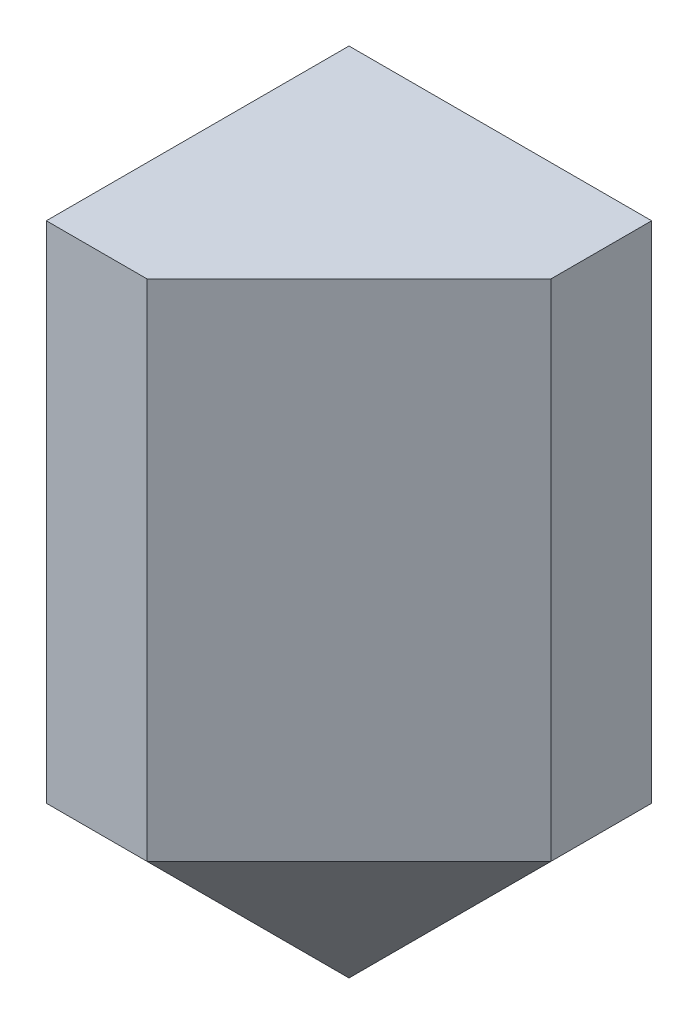
from build123d import *

# Parameters (mm, degrees)
SCHIZZO1_W                   = 30
SCHIZZO1_H                   = 40
ESTRUSIONE_ESTRUSIONE1_DEPTH = 30
SMUSSO1_SIZE                 = 20
ESTRUSIONE_ESTRUSIONE2_DEPTH = 30
FORO_PER_VITE_M5_1_D         = 5.5
FORO_PER_VITE_M5_1_DEPTH     = 13
FORO_PER_VITE_M5_1_TIP       = 1.652366702
FORO_PER_VITE_M5_2_D         = 5.5
FORO_PER_VITE_M5_2_DEPTH     = 13
FORO_PER_VITE_M5_2_TIP       = 1.652366702
SCHIZZO6_R                   = 7.5
TAGLIO_ESTRUSIONE1_DEPTH     = 3
FORO_PER_VITE_M4_1_D         = 4.5
FORO_PER_VITE_M4_1_DEPTH     = 10
FORO_PER_VITE_M4_1_TIP       = 1.351936393


with BuildPart() as part:
    # Schizzo1 → Estrusione-Estrusione1 (new body)
    with BuildSketch(Plane.XY):
        with Locations((15, 20)):
            Rectangle(SCHIZZO1_W, SCHIZZO1_H)
    extrude(amount=ESTRUSIONE_ESTRUSIONE1_DEPTH)

    # Smusso1
    smusso1_edges = [part.edges().sort_by_distance(p)[0] for p in [
        (30, 20, 30),
        (30, 0, 15),
        (15, 0, 30),
    ]]
    chamfer(smusso1_edges, length=SMUSSO1_SIZE)

    # Schizzo2 → Estrusione-Estrusione2 (add)
    with BuildSketch(Plane(origin=(0, 40, 0), x_dir=(1, 0, 0), z_dir=(0, 1, 0))):
        Polygon((0, 0), (30, 0), (30, -10), (10, -30), (0, -30), align=None)
    extrude(amount=ESTRUSIONE_ESTRUSIONE2_DEPTH)

    # Foro per Vite M5-1
    with Locations(Plane.ZY):
        with Locations((18, 20), (18, 48)):
            Hole(FORO_PER_VITE_M5_1_D / 2, depth=FORO_PER_VITE_M5_1_DEPTH)
            with Locations((0, 0, -(FORO_PER_VITE_M5_1_DEPTH + FORO_PER_VITE_M5_1_TIP / 2))):  # 118° drill point
                Cone(0, FORO_PER_VITE_M5_1_D / 2, FORO_PER_VITE_M5_1_TIP, mode=Mode.SUBTRACT)

    # Foro per Vite M5-2
    with Locations(Plane(origin=(18, 20, 0), x_dir=(-1, 0, 0), z_dir=(0, 0, -1))):
        with Locations((0, 0)):
            Hole(FORO_PER_VITE_M5_2_D / 2, depth=FORO_PER_VITE_M5_2_DEPTH)
            with Locations((0, 0, -(FORO_PER_VITE_M5_2_DEPTH + FORO_PER_VITE_M5_2_TIP / 2))):  # 118° drill point
                Cone(0, FORO_PER_VITE_M5_2_D / 2, FORO_PER_VITE_M5_2_TIP, mode=Mode.SUBTRACT)

    # Schizzo6 → Taglio-Estrusione1 (cut)
    with BuildSketch(Plane(origin=(0, 0, 0), x_dir=(-1, 0, 0), z_dir=(0, 0, -1))):
        with Locations((-15, 55)):
            Circle(SCHIZZO6_R)
    extrude(amount=-TAGLIO_ESTRUSIONE1_DEPTH, mode=Mode.SUBTRACT)

    # Foro per Vite M4-1
    with Locations(Plane(origin=(0, 0, 3), x_dir=(-1, 0, 0), z_dir=(0, 0, -1))):
        with Locations((-15, 55)):
            Hole(FORO_PER_VITE_M4_1_D / 2, depth=FORO_PER_VITE_M4_1_DEPTH)
            with Locations((0, 0, -(FORO_PER_VITE_M4_1_DEPTH + FORO_PER_VITE_M4_1_TIP / 2))):  # 118° drill point
                Cone(0, FORO_PER_VITE_M4_1_D / 2, FORO_PER_VITE_M4_1_TIP, mode=Mode.SUBTRACT)


solid = part.part
